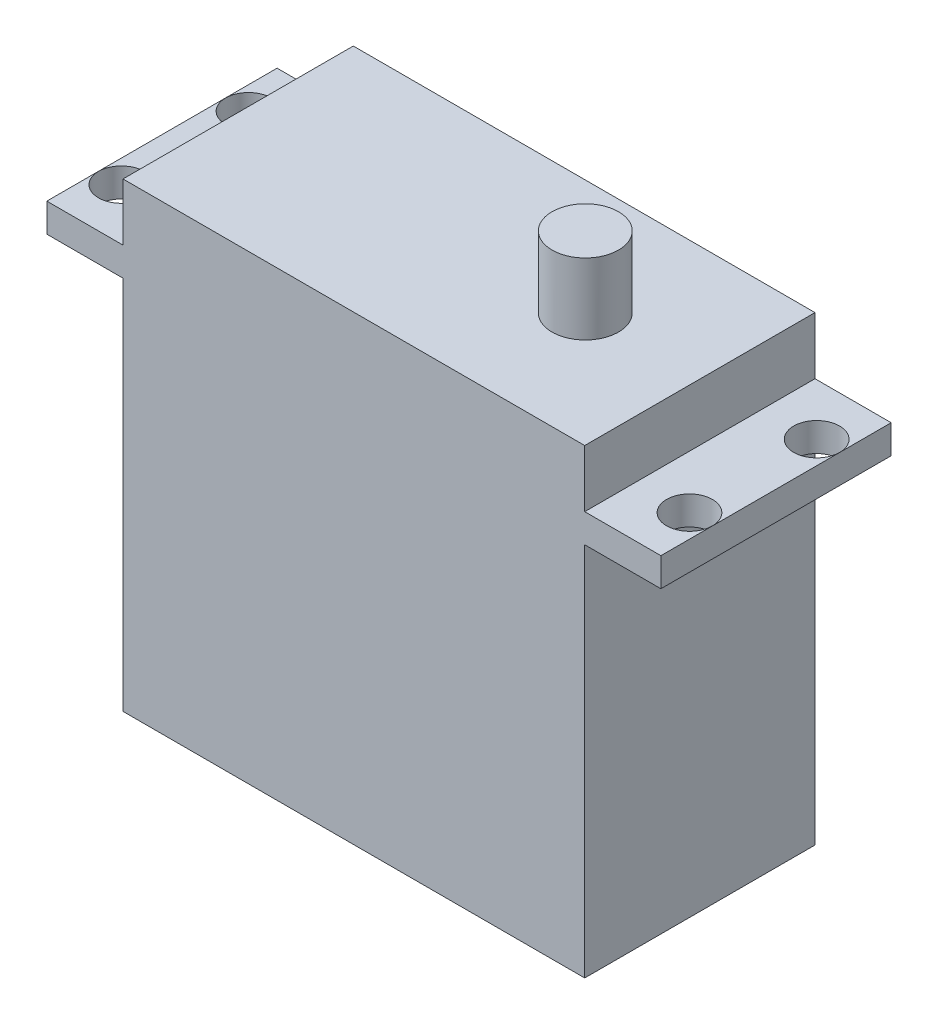
from build123d import *

# Parameters (mm, degrees)
SKETCH1_W           = 40.3
SKETCH1_H           = 20.1
BOSS_EXTRUDE1_DEPTH = 40.25
SKETCH2_R           = 2.9
BOSS_EXTRUDE2_DEPTH = 6.2
BOSS_EXTRUDE3_START = -5
SKETCH3_W           = 6.65
SKETCH3_H           = 20.1
SKETCH3_R           = 2
BOSS_EXTRUDE3_DEPTH = 2.5


with BuildPart() as part:
    # Sketch1 → Boss-Extrude1 (new body)
    with BuildSketch(Plane(origin=(0, 0, 0), x_dir=(1, 0, 0), z_dir=(0, 1, 0))):
        Rectangle(SKETCH1_W, SKETCH1_H)
    extrude(amount=BOSS_EXTRUDE1_DEPTH)

    # Sketch2 → Boss-Extrude2 (add)
    with BuildSketch(Plane(origin=(0, 40.25, 0), x_dir=(1, 0, 0), z_dir=(0, 1, 0))):
        with Locations(Location((10.15, 0, 0), (0, 0, 90))):
            Circle(SKETCH2_R)
    extrude(amount=BOSS_EXTRUDE2_DEPTH)

    # Sketch3 → Boss-Extrude3 (add)
    # profile 1 of 2: a face of its own
    with BuildSketch(Plane(origin=(0, 40.25, 0), x_dir=(1, 0, 0), z_dir=(0, 1, 0)).offset(BOSS_EXTRUDE3_START)):
        with Locations((-23.475, 0)):
            Rectangle(SKETCH3_W, SKETCH3_H)
        with Locations(Location((-24.794421729, 5.55, 0), (0, 0, 270))):
            Circle(SKETCH3_R, mode=Mode.SUBTRACT)
        with Locations(Location((-24.794421729, -5.55, 0), (0, 0, 270))):
            Circle(SKETCH3_R, mode=Mode.SUBTRACT)
    # profile 2 of 2: a face of its own
    with BuildSketch(Plane(origin=(0, 40.25, 0), x_dir=(1, 0, 0), z_dir=(0, 1, 0)).offset(BOSS_EXTRUDE3_START)):
        with Locations((23.475, 0)):
            Rectangle(SKETCH3_W, SKETCH3_H)
        with Locations(Location((24.794421729, -5.55, 0), (0, 0, 270))):
            Circle(SKETCH3_R, mode=Mode.SUBTRACT)
        with Locations(Location((24.794421729, 5.55, 0), (0, 0, 270))):
            Circle(SKETCH3_R, mode=Mode.SUBTRACT)
    extrude(amount=-BOSS_EXTRUDE3_DEPTH)


solid = part.part
